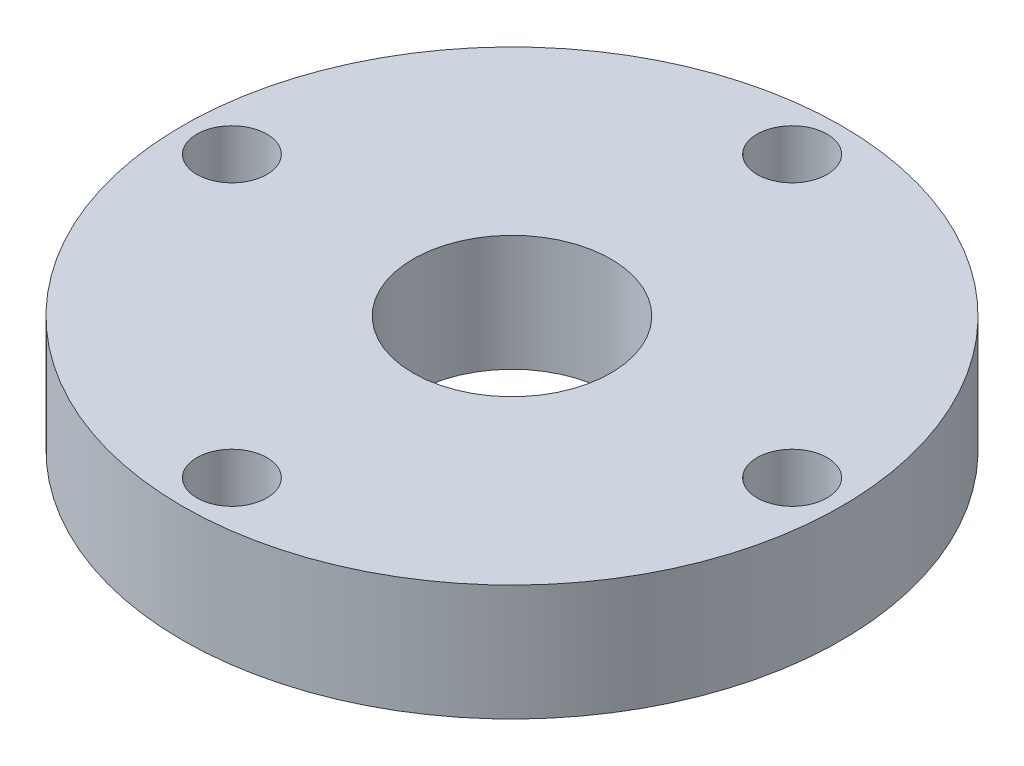
from build123d import *

# Parameters (mm, degrees)
SKETCH1_W           = 22.352
SKETCH1_H           = 63.5
CUT_EXTRUDE2_START  = 11.176
SKETCH2_R           = 19.05
CUT_EXTRUDE2_DEPTH  = 102.671320188
CUT_EXTRUDE4_START  = 11.176
SKETCH3_R           = 4.3688
CUT_EXTRUDE4_DEPTH  = 127
CUT_EXTRUDE6_START  = 11.176
SKETCH4_R           = 6.7437
CUT_EXTRUDE6_DEPTH  = 9.652
CUT_EXTRUDE8_START  = 11.176
SKETCH5_R           = 4.3688
CUT_EXTRUDE8_DEPTH  = 127
CUT_EXTRUDE10_START = 11.176
SKETCH6_R           = 6.7437
CUT_EXTRUDE10_DEPTH = 9.652


with BuildPart() as part:
    # Sketch1 → Revolve1 (revolve)
    with BuildSketch(Plane(origin=(0, 0, 0), x_dir=(0, 1, 0), z_dir=(0, 0, 1)), mode=Mode.PRIVATE) as revolve1_sk:
        with Locations((0, 31.75)):
            Rectangle(SKETCH1_W, SKETCH1_H)
    revolve(revolve1_sk.sketch.rotate(Axis((0, -36.576, 0), (0, 1, 0)), 270), axis=Axis((0, -36.576, 0), (0, 1, 0)))

    # Sketch2 → Cut-Extrude2 (cut, through all)
    with BuildSketch(Plane(origin=(0, 0, 0), x_dir=(-1, 0, 0), z_dir=(0, 1, 0)).offset(CUT_EXTRUDE2_START)):
        with Locations(Location((0, 0, 0), (0, 0, 90))):
            Circle(SKETCH2_R)
    extrude(amount=-CUT_EXTRUDE2_DEPTH, mode=Mode.SUBTRACT)

    # Sketch3 → Cut-Extrude4 (cut)
    with BuildSketch(Plane(origin=(0, 0, 0), x_dir=(-1, 0, 0), z_dir=(0, 1, 0)).offset(CUT_EXTRUDE4_START)):
        with Locations(Location((53.975, 0, 0), (0, 0, 90))):
            Circle(SKETCH3_R)
    extrude(amount=-CUT_EXTRUDE4_DEPTH, mode=Mode.SUBTRACT)

    # Sketch4 → Cut-Extrude6 (cut)
    with BuildSketch(Plane(origin=(0, 0, 0), x_dir=(-1, 0, 0), z_dir=(0, 1, 0)).offset(CUT_EXTRUDE6_START)):
        with Locations(Location((53.975, 0, 0), (0, 0, 90))):
            Circle(SKETCH4_R)
    extrude(amount=-CUT_EXTRUDE6_DEPTH, mode=Mode.SUBTRACT)

    # Sketch5 → Cut-Extrude8 (cut)
    with BuildSketch(Plane(origin=(0, 0, 0), x_dir=(-1, 0, 0), z_dir=(0, 1, 0)).offset(CUT_EXTRUDE8_START)):
        with Locations(Location((0, 53.975, 0), (0, 0, 90))):
            Circle(SKETCH5_R)
        with Locations(Location((-53.975, 0, 0), (0, 0, 90))):
            Circle(SKETCH5_R)
        with Locations(Location((0, -53.975, 0), (0, 0, 90))):
            Circle(SKETCH5_R)
    extrude(amount=-CUT_EXTRUDE8_DEPTH, mode=Mode.SUBTRACT)

    # Sketch6 → Cut-Extrude10 (cut)
    with BuildSketch(Plane(origin=(0, 0, 0), x_dir=(-1, 0, 0), z_dir=(0, 1, 0)).offset(CUT_EXTRUDE10_START)):
        with Locations(Location((0, 53.975, 0), (0, 0, 90))):
            Circle(SKETCH6_R)
        with Locations(Location((-53.975, 0, 0), (0, 0, 90))):
            Circle(SKETCH6_R)
        with Locations(Location((0, -53.975, 0), (0, 0, 90))):
            Circle(SKETCH6_R)
    extrude(amount=-CUT_EXTRUDE10_DEPTH, mode=Mode.SUBTRACT)


solid = part.part
